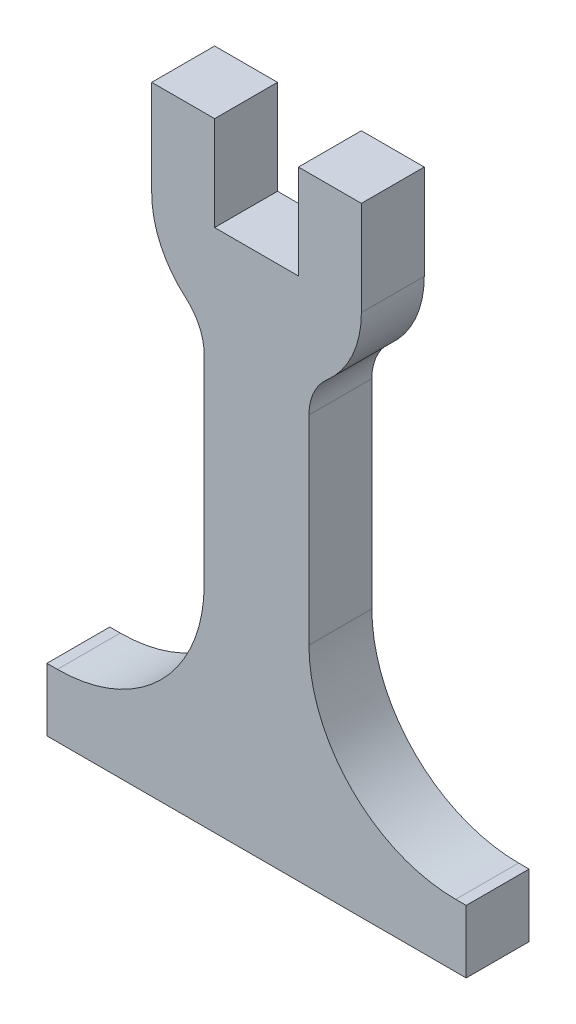
from build123d import *

# Parameters (mm, degrees)
RESSALTO_EXTRUS_O1_DEPTH = 3


with BuildPart() as part:
    # Esboço1 → Ressalto-extrusão1 (new body)
    with BuildSketch(Plane.XY):
        with BuildLine():
            Line((3, 0), (7, 0))
            Line((7, 0), (7, 3))
            Line((7, 3), (7, 4.5))
            Line((7, 4.5), (10, 4.5))
            Line((10, 4.5), (10, 3))
            Line((10, 3), (10, 0))
            Line((10, 0), (10, -0.015366586))
            ThreePointArc((10, -0.015366586), (9.570424226, -1.990324177), (8.359319479, -3.608415065))
            ThreePointArc((8.359319479, -3.608415065), (7.72499373, -4.455903043), (7.5, -5.490302797))
            Line((7.5, -5.490302797), (7.5, -6.25))
            Line((7.5, -6.25), (7.5, -12.5))
            Line((7.5, -12.5), (7.5, -15))
            ThreePointArc((7.5, -15), (9.550252532, -19.949747468), (14.5, -22))
            Line((14.5, -22), (15, -22))
            Line((15, -22), (15, -25))
            Line((15, -25), (-5, -25))
            Line((-5, -25), (-5, -22))
            Line((-5, -22), (-4.5, -22))
            ThreePointArc((-4.5, -22), (0.449747468, -19.949747468), (2.5, -15))
            Line((2.5, -15), (2.5, -12.5))
            Line((2.5, -12.5), (2.5, -6.25))
            Line((2.5, -6.25), (2.5, -5.490302797))
            ThreePointArc((2.5, -5.490302797), (2.270627847, -4.446367624), (1.62476455, -3.594738109))
            ThreePointArc((1.62476455, -3.594738109), (0.425800558, -2.013795009), (0, -0.075860639))
            Line((0, -0.075860639), (0, 0))
            Line((0, 0), (0, 3))
            Line((0, 3), (0, 4.5))
            Line((0, 4.5), (3, 4.5))
            Line((3, 4.5), (3, 3))
            Line((3, 3), (3, 0))
        make_face()
    extrude(amount=RESSALTO_EXTRUS_O1_DEPTH)


solid = part.part
